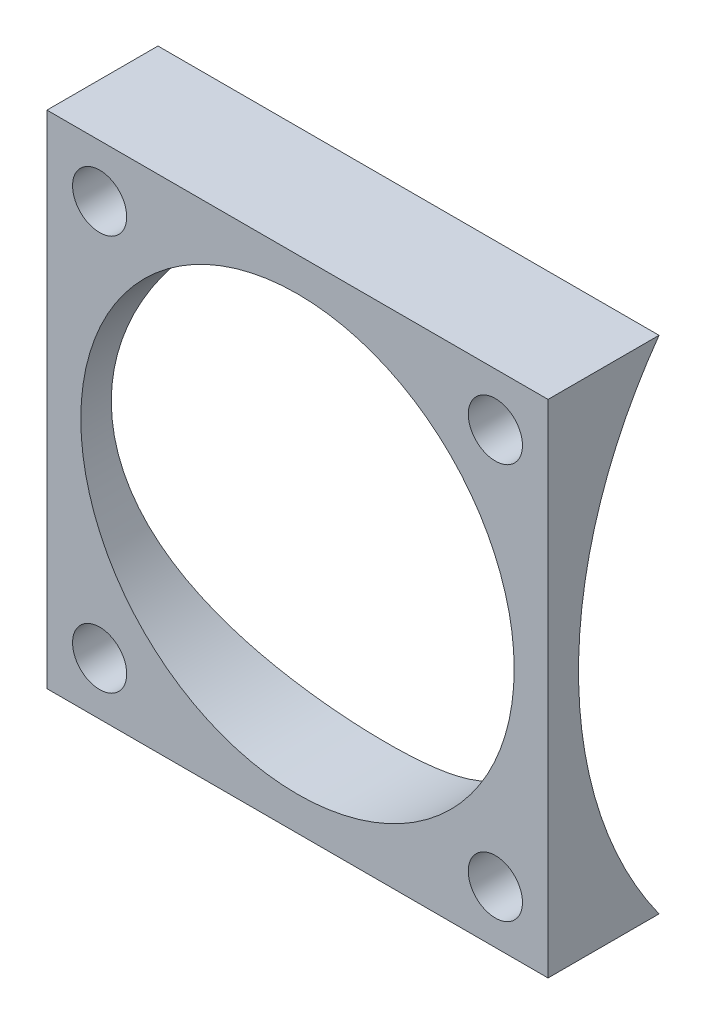
from build123d import *

# Parameters (mm, degrees)
SKETCH1_W               = 37
SKETCH1_H               = 37
BOSS_EXTRUDE1_DEPTH     = 34
CUT_EXTRUDE1_DEPTH      = 20
CUT_EXTRUDE1_DEPTH_BACK = 20
SKETCH2_R               = 31.75
SKETCH5_R               = 16
CUT_EXTRUDE2_DEPTH      = 43.901048938
SKETCH6_R               = 2
CUT_EXTRUDE3_DEPTH      = 28.41687798


with BuildPart() as part:
    # Sketch1 → Boss-Extrude1 (new body)
    with BuildSketch(Plane.XY):
        Rectangle(SKETCH1_W, SKETCH1_H)
    extrude(amount=BOSS_EXTRUDE1_DEPTH)

    # Sketch2 → Cut-Extrude1 (cut, two sides: drawn at the far end of the back side and taken through both)
    with BuildSketch(Plane(origin=(0, 0, 0), x_dir=(0, 0, -1), z_dir=(1, 0, 0)).offset(-CUT_EXTRUDE1_DEPTH_BACK)):
        Circle(SKETCH2_R)
    extrude(amount=CUT_EXTRUDE1_DEPTH + CUT_EXTRUDE1_DEPTH_BACK, mode=Mode.SUBTRACT)

    # Sketch5 → Cut-Extrude2 (cut, through all)
    with BuildSketch(Plane.XY):
        with Locations(Location((0, 0, 0), (0, 0, 180))):
            Circle(SKETCH5_R)
    extrude(amount=CUT_EXTRUDE2_DEPTH, mode=Mode.SUBTRACT)

    # Sketch6 → Cut-Extrude3 (cut, through all)
    with BuildSketch(Plane.XY.offset(34)):
        with Locations((-14.610912703, -14.610912703)):
            Circle(SKETCH6_R)
        with Locations((14.610912703, -14.610912703)):
            Circle(SKETCH6_R)
        with Locations((14.610912703, 14.610912703)):
            Circle(SKETCH6_R)
        with Locations((-14.610912703, 14.610912703)):
            Circle(SKETCH6_R)
    extrude(amount=-CUT_EXTRUDE3_DEPTH, mode=Mode.SUBTRACT)


solid = part.part
